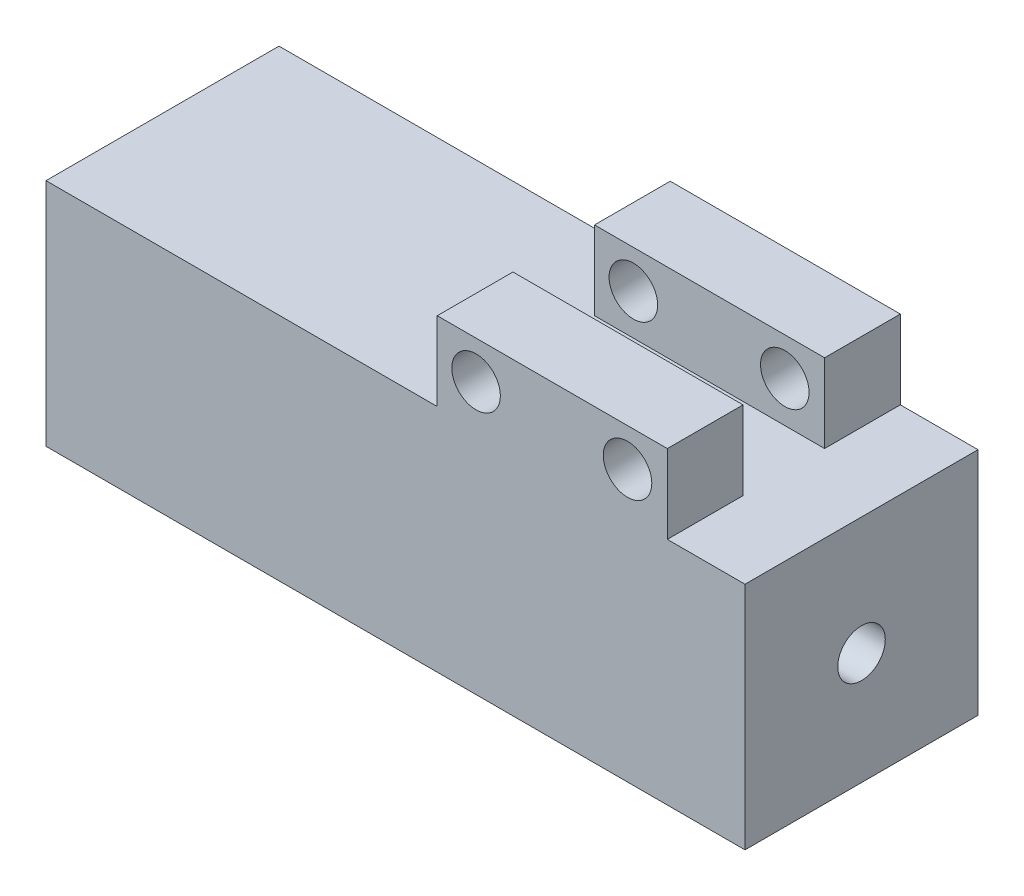
from build123d import *

# Parameters (mm, degrees)
SKETCH1_W               = 72
SKETCH1_H               = 23.7
BOSS_EXTRUDE1_DEPTH     = 12
SKETCH3_W               = 23.7
SKETCH3_H               = 7.8
BOSS_EXTRUDE2_DEPTH     = 8.1
SKETCH2_R               = 2.45
CUT_EXTRUDE1_DEPTH      = 60
CUT_EXTRUDE2_DEPTH      = 43.871931377
CUT_EXTRUDE2_DEPTH_BACK = 43.871931377
SKETCH4_R               = 2.5


with BuildPart() as part:
    # Sketch1 → Boss-Extrude1 (new, symmetric)
    with BuildSketch(Plane.XY):
        Rectangle(SKETCH1_W, SKETCH1_H)
    extrude(amount=BOSS_EXTRUDE1_DEPTH, both=True)

    # Sketch3 → Boss-Extrude2 (add)
    with BuildSketch(Plane(origin=(0, 11.85, 0), x_dir=(1, 0, 0), z_dir=(0, 1, 0))):
        with Locations((16.15, -8.1)):
            Rectangle(SKETCH3_W, SKETCH3_H)
        with Locations((16.15, 8.1)):
            Rectangle(SKETCH3_W, SKETCH3_H)
    extrude(amount=BOSS_EXTRUDE2_DEPTH)

    # Sketch2 → Cut-Extrude1 (cut)
    with BuildSketch(Plane(origin=(36, 0, 0), x_dir=(0, 0, -1), z_dir=(1, 0, 0))):
        with Locations((0, -0.3)):
            Circle(SKETCH2_R)
    extrude(amount=-CUT_EXTRUDE1_DEPTH, mode=Mode.SUBTRACT)

    # Sketch4 → Cut-Extrude2 (cut, two sides: drawn at the far end of the back side and taken through both)
    with BuildSketch(Plane.XY.offset(-CUT_EXTRUDE2_DEPTH_BACK)):
        with Locations((8.3, 16.05)):
            Circle(SKETCH4_R)
        with Locations((23.9, 16.05)):
            Circle(SKETCH4_R)
    extrude(amount=CUT_EXTRUDE2_DEPTH + CUT_EXTRUDE2_DEPTH_BACK, mode=Mode.SUBTRACT)


solid = part.part
